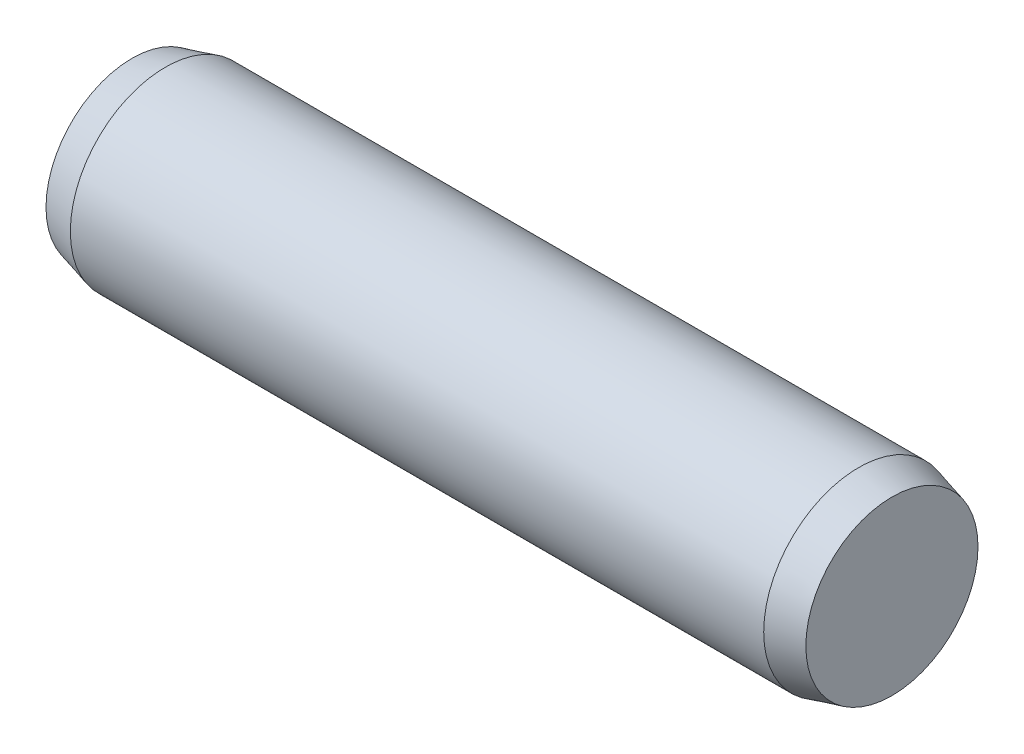
from build123d import *

# Parameters (mm, degrees)
EXTRUDE1_DEPTH      = 3.65
EXTRUDE1_DEPTH_BACK = 3.65
SKETCH2_R           = 1
SKETCH3_R           = 1
EXTRUDE2_DEPTH      = 0.35
EXTRUDE2_TAPER      = 15
SKETCH4_R           = 1
EXTRUDE3_DEPTH      = 0.35
EXTRUDE3_TAPER      = 15


with BuildPart() as part:
    # Sketch2 → Extrude1 (new, two sides: drawn at the far end of the back side and taken through both)
    with BuildSketch(Plane(origin=(0, 0, 0), x_dir=(0, 0, -1), z_dir=(1, 0, 0)).offset(-EXTRUDE1_DEPTH_BACK)):
        Circle(SKETCH2_R)
    extrude(amount=EXTRUDE1_DEPTH + EXTRUDE1_DEPTH_BACK)

    # Sketch3 → Extrude2 (add)
    with BuildSketch(Plane(origin=(3.65, 0, 0), x_dir=(0, 0, -1), z_dir=(1, 0, 0))):
        Circle(SKETCH3_R)
    extrude(amount=EXTRUDE2_DEPTH, taper=EXTRUDE2_TAPER)

    # Sketch4 → Extrude3 (add)
    with BuildSketch(Plane.ZY.offset(3.65)):
        with Locations(Location((0, 0, 0), (0, 0, 180))):
            Circle(SKETCH4_R)
    extrude(amount=EXTRUDE3_DEPTH, taper=EXTRUDE3_TAPER)


solid = part.part
